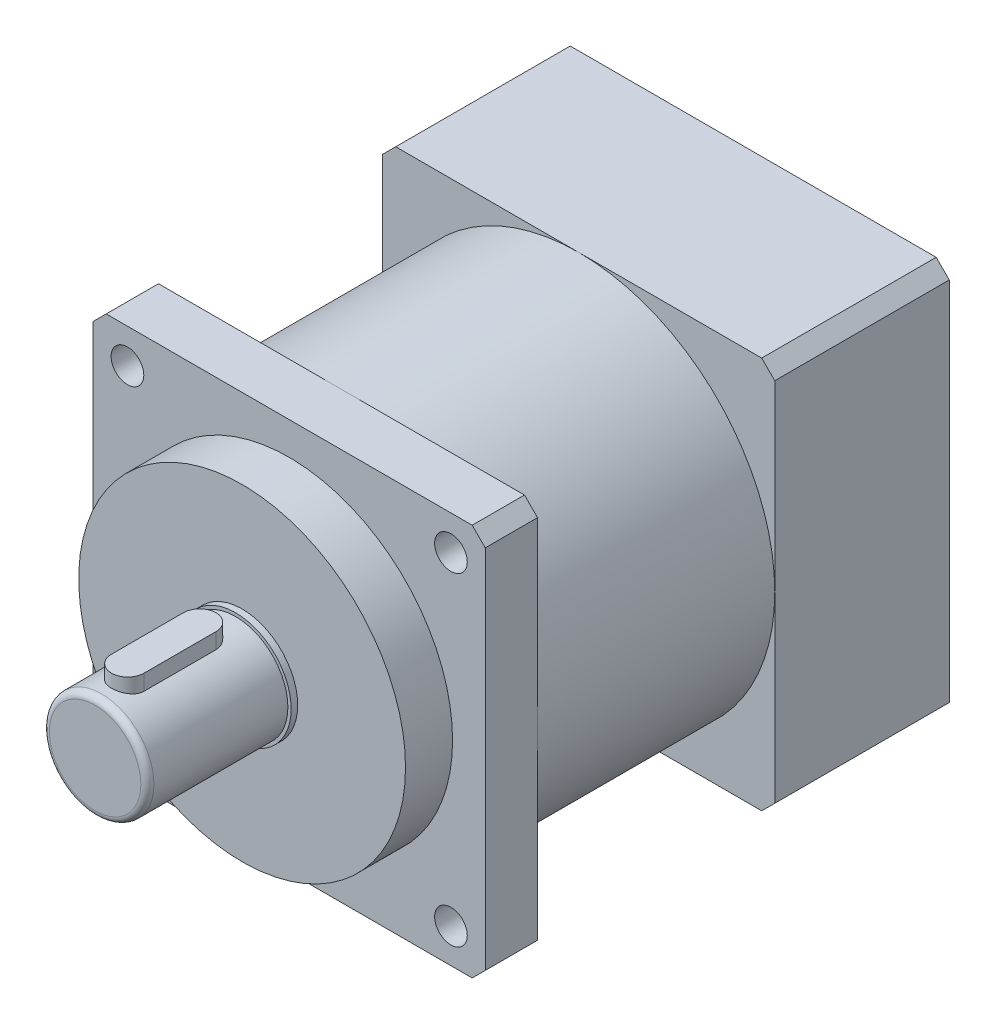
from build123d import *

# Parameters (mm, degrees)
SKETCH_1_W          = 60
SKETCH_1_H          = 60
EXTRUDE_1_DEPTH     = 26.7
SKETCH_2_R          = 25
CUT_EXTRUDE_1_DEPTH = 3
SKETCH_3_R          = 7
CUT_EXTRUDE_2_DEPTH = 49.597222143
SKETCH_4_R          = 1.65
CUT_EXTRUDE_3_DEPTH = 10
SKETCH_5_R          = 30
EXTRUDE_2_DEPTH     = 36.3
SKETCH_6_W          = 60
SKETCH_6_H          = 60
EXTRUDE_3_DEPTH     = 8
SKETCH_7_R          = 25
EXTRUDE_4_DEPTH     = 7.2
SKETCH_8_R          = 8
EXTRUDE_5_DEPTH     = 22.5
SKETCH_9_R          = 2.5
CUT_EXTRUDE_4_DEPTH = 8
EXTRUDE_6_DEPTH     = 10
CHAMFER_1_SIZE      = 2
FILLET_1_R          = 1
SKETCH_11_R         = 8.5
EXTRUDE_7_DEPTH     = 1


with BuildPart() as part:
    # 草图1 → 凸台-拉伸1 (new body)
    with BuildSketch(Plane.XY):
        Rectangle(SKETCH_1_W, SKETCH_1_H)
    extrude(amount=EXTRUDE_1_DEPTH)

    # 草图2 → 切除-拉伸1 (cut)
    with BuildSketch(Plane(origin=(0, 0, 0), x_dir=(-1, 0, 0), z_dir=(0, 0, -1))):
        Circle(SKETCH_2_R)
    extrude(amount=-CUT_EXTRUDE_1_DEPTH, mode=Mode.SUBTRACT)

    # 草图3 → 切除-拉伸2 (cut, through all)
    with BuildSketch(Plane(origin=(0, 0, 3), x_dir=(-1, 0, 0), z_dir=(0, 0, -1))):
        Circle(SKETCH_3_R)
    extrude(amount=-CUT_EXTRUDE_2_DEPTH, mode=Mode.SUBTRACT)

    # 草图4 → 切除-拉伸3 (cut)
    with BuildSketch(Plane(origin=(0, 0, 0), x_dir=(-1, 0, 0), z_dir=(0, 0, -1))):
        with Locations((24.748737342, 24.748737342)):
            Circle(SKETCH_4_R)
        with Locations((-24.748737342, 24.748737342)):
            Circle(SKETCH_4_R)
        with Locations((24.748737342, -24.748737342)):
            Circle(SKETCH_4_R)
        with Locations((-24.748737342, -24.748737342)):
            Circle(SKETCH_4_R)
    extrude(amount=-CUT_EXTRUDE_3_DEPTH, mode=Mode.SUBTRACT)

    # 草图5 → 凸台-拉伸2 (add)
    with BuildSketch(Plane.XY.offset(26.7)):
        Circle(SKETCH_5_R)
    extrude(amount=EXTRUDE_2_DEPTH)

    # 草图6 → 凸台-拉伸3 (add)
    with BuildSketch(Plane.XY.offset(63)):
        Rectangle(SKETCH_6_W, SKETCH_6_H)
    extrude(amount=EXTRUDE_3_DEPTH)

    # 草图7 → 凸台-拉伸4 (add)
    with BuildSketch(Plane.XY.offset(71)):
        with Locations(Location((0, 0, 0), (0, 0, 180))):
            Circle(SKETCH_7_R)
    extrude(amount=EXTRUDE_4_DEPTH)

    # 草图8 → 凸台-拉伸5 (add)
    with BuildSketch(Plane.XY.offset(78.2)):
        with Locations(Location((0, 0, 0), (0, 0, 180))):
            Circle(SKETCH_8_R)
    extrude(amount=EXTRUDE_5_DEPTH)

    # 草图9 → 切除-拉伸4 (cut)
    with BuildSketch(Plane.XY.offset(71)):
        with Locations((-24.748737342, 24.748737342)):
            Circle(SKETCH_9_R)
        with Locations((24.748737342, 24.748737342)):
            Circle(SKETCH_9_R)
        with Locations((24.748737342, -24.748737342)):
            Circle(SKETCH_9_R)
        with Locations((-24.748737342, -24.748737342)):
            Circle(SKETCH_9_R)
    extrude(amount=-CUT_EXTRUDE_4_DEPTH, mode=Mode.SUBTRACT)

    # 草图10 → 凸台-拉伸6 (add)
    with BuildSketch(Plane(origin=(0, 0, 0), x_dir=(1, 0, 0), z_dir=(0, 1, 0))):
        with BuildLine():
            Line((2.5, -84.7), (2.5, -95.7))
            ThreePointArc((2.5, -95.7), (0, -98.2), (-2.5, -95.7))
            Line((-2.5, -95.7), (-2.5, -84.7))
            ThreePointArc((-2.5, -84.7), (0, -82.2), (2.5, -84.7))
        make_face()
    extrude(amount=EXTRUDE_6_DEPTH)

    # 倒角1
    chamfer_1_edges = [part.edges().sort_by_distance(p)[0] for p in [
        (-30, 30, 67),
        (-30, -30, 67),
        (30, -30, 67),
        (30, 30, 67),
        (30, -30, 13.35),
        (-30, -30, 13.35),
        (-30, 30, 13.35),
        (30, 30, 13.35),
    ]]
    chamfer(chamfer_1_edges, length=CHAMFER_1_SIZE)

    # 圆角1
    fillet_1_edges = [part.edges().sort_by_distance(p)[0] for p in [
        (8, 0, 100.7),
    ]]
    fillet(fillet_1_edges, radius=FILLET_1_R)

    # 草图11 → 凸台-拉伸7 (add)
    with BuildSketch(Plane.XY.offset(78.2)):
        Circle(SKETCH_11_R)
    extrude(amount=EXTRUDE_7_DEPTH)


solid = part.part
